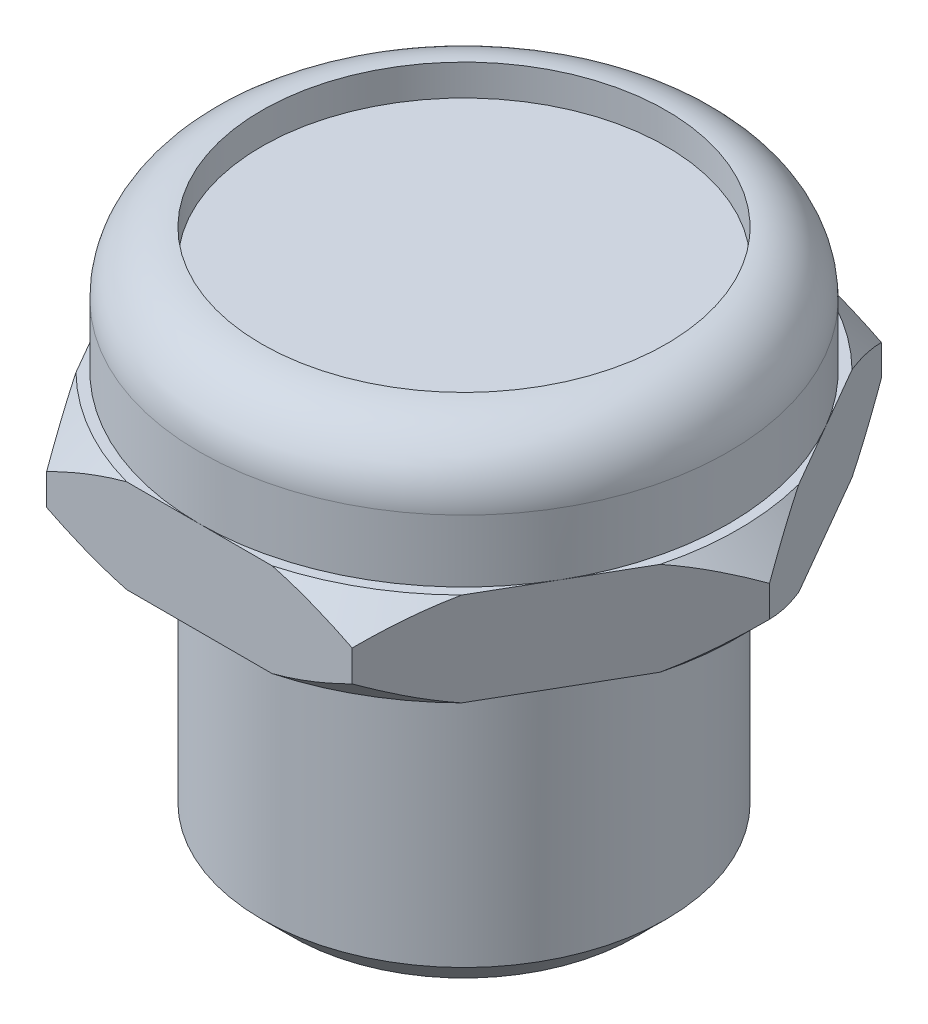
from build123d import *

# Parameters (mm, degrees)
EXTRUDE_1_DEPTH     = 3
SKETCH_3_R          = 8.5
EXTRUDE_2_DEPTH     = 4
FILLET_1_R          = 2
SKETCH_4_R          = 6.5
CUT_EXTRUDE_1_DEPTH = 1
SKETCH_5_R          = 6.5
EXTRUDE_3_DEPTH     = 10
CHAMFER_1_SIZE      = 1
SKETCH_6_R          = 4.5
CUT_EXTRUDE_2_DEPTH = 15


with BuildPart() as part:
    # Эскиз1 → Бобышка-Вытянуть1 (new body)
    with BuildSketch(Plane(origin=(0, 0, 0), x_dir=(1, 0, 0), z_dir=(0, 1, 0))):
        Polygon((9.814954576, 0), (4.907477288, 8.5), (-4.907477288, 8.5), (-9.814954576, 0), (-4.907477288, -8.5), (4.907477288, -8.5), align=None)
    extrude(amount=EXTRUDE_1_DEPTH)

    # Эскиз2 → Вырез-Повернуть2 (revolve, cut)
    with BuildSketch(Plane.XY):
        Polygon((9.814954576, 1), (8.814954576, 0), (9.814954576, 0), align=None)
    cut_revolve_2 = revolve(axis=Axis((0, 10.488289755, 0), (0, -1, 0)), mode=Mode.SUBTRACT)

    # Зеркальное отражение1: Вырез-Повернуть2 across plane
    add(cut_revolve_2.mirror(Plane.ZX.offset(1.5)), mode=Mode.SUBTRACT)

    # Эскиз3 → Бобышка-Вытянуть2 (add)
    with BuildSketch(Plane(origin=(0, 3, 0), x_dir=(1, 0, 0), z_dir=(0, 1, 0))):
        with Locations(Location((0, 0, 0), (0, 0, 270))):
            Circle(SKETCH_3_R)
    extrude(amount=EXTRUDE_2_DEPTH)

    # Скругление1
    fillet_1_edges = [part.edges().sort_by_distance(p)[0] for p in [
        (0, 7, -8.5),
    ]]
    fillet(fillet_1_edges, radius=FILLET_1_R)

    # Эскиз4 → Вырез-Вытянуть1 (cut)
    with BuildSketch(Plane(origin=(0, 7, 0), x_dir=(1, 0, 0), z_dir=(0, 1, 0))):
        with Locations(Location((0, 0, 0), (0, 0, 270))):
            Circle(SKETCH_4_R)
    extrude(amount=-CUT_EXTRUDE_1_DEPTH, mode=Mode.SUBTRACT)

    # Эскиз5 → Бобышка-Вытянуть3 (add)
    with BuildSketch(Plane.XZ):
        with Locations(Location((0, 0, 0), (0, 0, 90))):
            Circle(SKETCH_5_R)
    extrude(amount=EXTRUDE_3_DEPTH)

    # Фаска1
    chamfer_1_edges = [part.edges().sort_by_distance(p)[0] for p in [
        (0, -10, -6.5),
    ]]
    chamfer(chamfer_1_edges, length=CHAMFER_1_SIZE)

    # Эскиз6 → Вырез-Вытянуть2 (cut)
    with BuildSketch(Plane.XZ.offset(10)):
        with Locations(Location((0, 0, 0), (0, 0, 270))):
            Circle(SKETCH_6_R)
    extrude(amount=-CUT_EXTRUDE_2_DEPTH, mode=Mode.SUBTRACT)


solid = part.part
